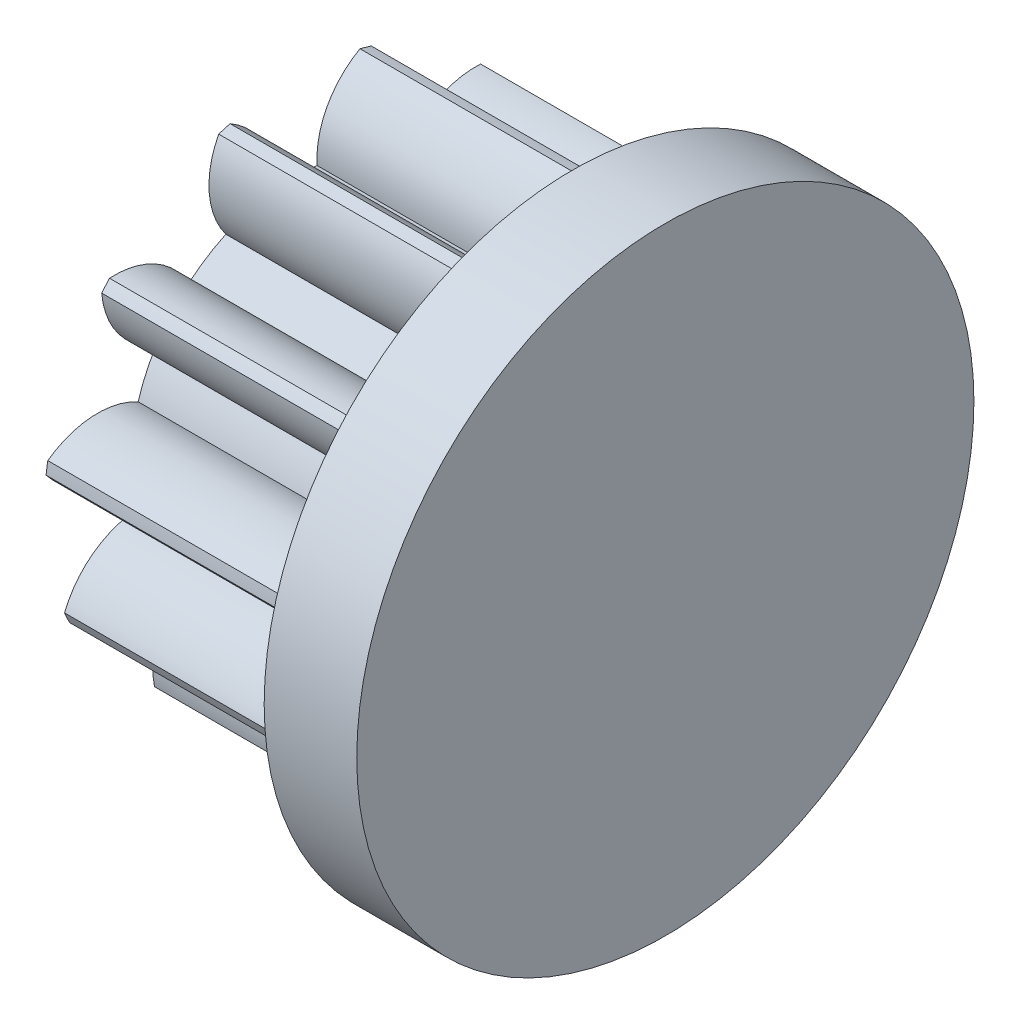
from build123d import *

# Parameters (mm, degrees)
BASPROSKE_W         = 9
BASPROSKE_H         = 8.125
TOOTHCUT_DEPTH      = 15.595590087
TEETHCUTS_COUNT     = 11
TEETHCUTS_ANGLE     = 327.272727273
BORSKE_R            = 0.5
BORE_DEPTH          = 50.0000508
SKETCH1_R           = 10
BOSS_EXTRUDE1_DEPTH = 3


with BuildPart() as part:
    # BasProSke → Base-Revolve (revolve)
    with BuildSketch(Plane(origin=(0, 0, 0), x_dir=(1, 0, 0), z_dir=(0, 1, 0)), mode=Mode.PRIVATE) as base_revolve_sk:
        with Locations((4.5, 4.0625)):
            Rectangle(BASPROSKE_W, BASPROSKE_H)
    revolve(base_revolve_sk.sketch.rotate(Axis((-10, 0, 0), (1, 0, 0)), 180), axis=Axis((-10, 0, 0), (1, 0, 0)))

    # TooCutSke → ToothCut (cut, through all)
    with BuildSketch(Plane(origin=(0, 0, 0), x_dir=(0, 0, -1), z_dir=(1, 0, 0))):
        with BuildLine():
            ThreePointArc((0.716661614, 5.262929639), (0, 5.3115), (-0.716661614, 5.262929639))
            ThreePointArc((-0.716661614, 5.262929639), (-1.045232485, 6.771828733), (-2.135233901, 7.865735589))
            ThreePointArc((-2.135233901, 7.865735589), (0, 8.1504), (2.135233901, 7.865735589))
            ThreePointArc((2.135233901, 7.865735589), (1.045232485, 6.771828733), (0.716661614, 5.262929639))
        make_face()
    toothcut = extrude(amount=TOOTHCUT_DEPTH, mode=Mode.SUBTRACT)

    # TeethCuts: ToothCut ×11 about axis
    teethcuts_axis = Axis((-10, 0, 0), (1, 0, 0))
    for i in range(1, TEETHCUTS_COUNT):
        add(toothcut.rotate(teethcuts_axis, i * TEETHCUTS_ANGLE / (TEETHCUTS_COUNT - 1)), mode=Mode.SUBTRACT)

    # BorSke → Bore (cut, symmetric)
    with BuildSketch(Plane(origin=(0, 0, 0), x_dir=(0, 0, -1), z_dir=(1, 0, 0))):
        with Locations(Location((0, 0, 0), (0, 0, 180))):
            Circle(BORSKE_R)
    extrude(amount=BORE_DEPTH, both=True, mode=Mode.SUBTRACT)

    # Sketch1 → Boss-Extrude1 (add)
    with BuildSketch(Plane(origin=(9, 0, 0), x_dir=(0, 0, -1), z_dir=(1, 0, 0))):
        Circle(SKETCH1_R)
    extrude(amount=BOSS_EXTRUDE1_DEPTH)


solid = part.part
